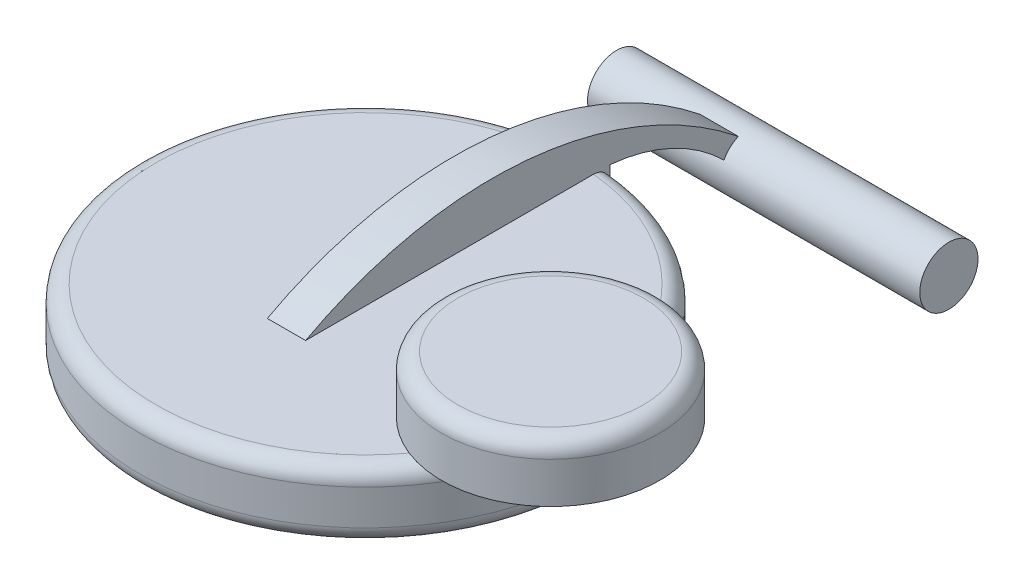
from build123d import *

# Parameters (mm, degrees)
SKETCH1_R           = 2.2606
BOSS_EXTRUDE1_DEPTH = 25.8064
BOSS_EXTRUDE2_DEPTH = 2.9718
SKETCH3_R           = 17.5514
BOSS_EXTRUDE3_DEPTH = 5.2832
FILLET1_R           = 1.27
SKETCH4_R           = 8.4709
BOSS_EXTRUDE4_DEPTH = 4.445
FILLET2_R           = 1.27


with BuildPart() as part:
    # Sketch1 → Boss-Extrude1 (new body)
    with BuildSketch(Plane(origin=(0, 0, 0), x_dir=(0, 0, -1), z_dir=(1, 0, 0))):
        Circle(SKETCH1_R)
    extrude(amount=BOSS_EXTRUDE1_DEPTH)

    # Sketch2 → Boss-Extrude2 (add)
    with BuildSketch(Plane(origin=(7.366, 0, 0), x_dir=(0, 0, -1), z_dir=(1, 0, 0))):
        with BuildLine():
            Line((-34.4932, 5.1562), (-10.795, 5.1562))
            ThreePointArc((-10.795, 5.1562), (-4.640157933, 3.106734389), (0, -1.426622482))
            Line((0, -1.426622482), (0, 1.341450991))
            ThreePointArc((0, 1.341450991), (-16.651297211, 8.631590684), (-34.4932, 5.1562))
        make_face()
    extrude(amount=BOSS_EXTRUDE2_DEPTH)

    # Sketch3 → Boss-Extrude3 (add)
    with BuildSketch(Plane.XZ.offset(-5.1562)):
        with Locations(Location((8.8519, 28.3464, 0), (0, 0, 270))):
            Circle(SKETCH3_R)
    extrude(amount=BOSS_EXTRUDE3_DEPTH)

    # Fillet1
    fillet1_edges = [part.edges().sort_by_distance(p)[0] for p in [
        (8.8519, 5.1562, 45.8978),
        (8.8519, -0.127, 45.8978),
    ]]
    fillet(fillet1_edges, radius=FILLET1_R)

    # Sketch4 → Boss-Extrude4 (add)
    with BuildSketch(Plane(origin=(0, 5.1562, 0), x_dir=(1, 0, 0), z_dir=(0, 1, 0))):
        with Locations(Location((25.032233899, -30.157692599, 0), (0, 0, 98.691062449))):
            Circle(SKETCH4_R)
    extrude(amount=BOSS_EXTRUDE4_DEPTH)

    # Fillet2
    fillet2_edges = [part.edges().sort_by_distance(p)[0] for p in [
        (26.312242996, 9.6012, 38.531325234),
    ]]
    fillet(fillet2_edges, radius=FILLET2_R)


solid = part.part
